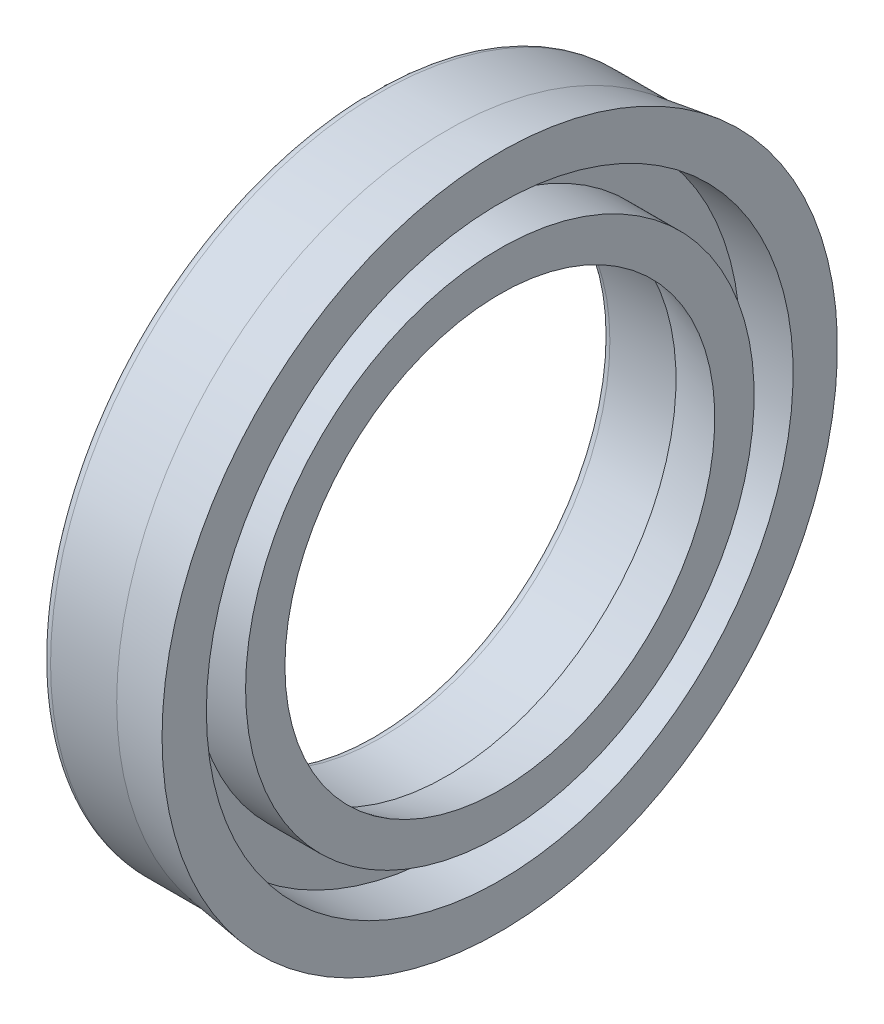
from build123d import *

# Parameters (mm, degrees)
FILLET1_R = 0.5
FILLET2_R = 0.5


with BuildPart() as part:
    # Sketch1 → Revolve1 (revolve)
    with BuildSketch(Plane.XY, mode=Mode.PRIVATE) as revolve1_sk:
        Polygon((0, 18), (0, 12.5), (4.106425474, 12.5), (7, 11.719895528), (7, 13.865829082), (4.106425474, 13.865829082), (4.106425474, 15.997428623), (6.99368707, 15.997428623), (6.99368707, 18), (6.99368707, 18.413964462), (4.106425474, 18), align=None)
    revolve(revolve1_sk.sketch.rotate(Axis((0, 0, 0), (1, 0, 0)), 90), axis=Axis((0, 0, 0), (1, 0, 0)))

    # Fillet1
    fillet1_edges = [part.edges().sort_by_distance(p)[0] for p in [
        (0, 0, -18),
    ]]
    fillet(fillet1_edges, radius=FILLET1_R)

    # Fillet2
    fillet2_edges = [part.edges().sort_by_distance(p)[0] for p in [
        (0, 0, -12.5),
    ]]
    fillet(fillet2_edges, radius=FILLET2_R)


solid = part.part
